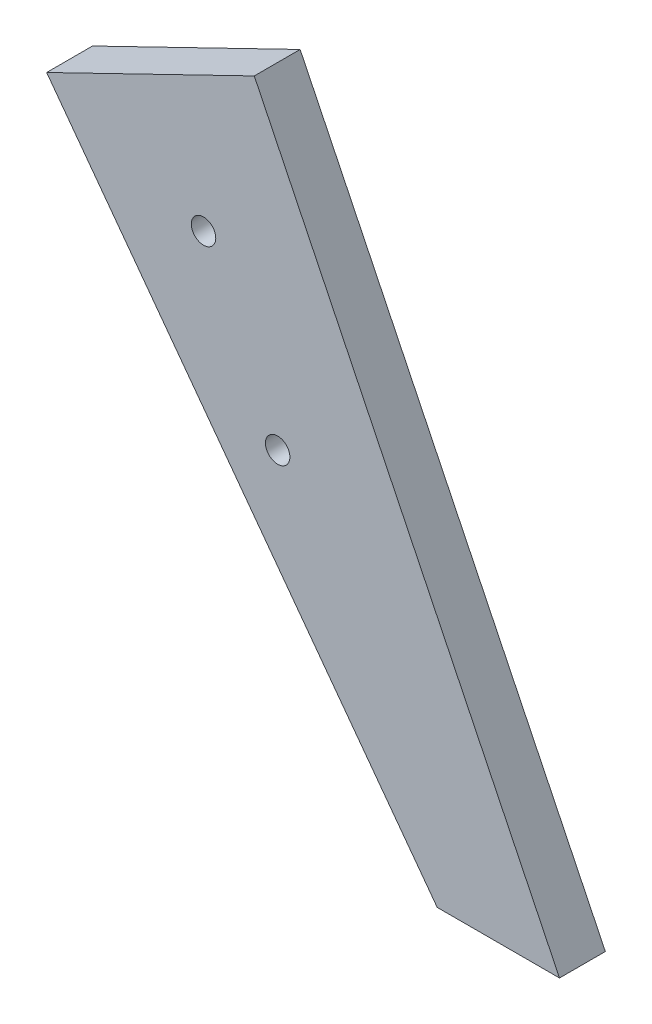
from build123d import *

# Parameters (mm, degrees)
SKETCH1_R           = 1.6
BOSS_EXTRUDE1_DEPTH = 6


with BuildPart() as part:
    # Sketch1 → Boss-Extrude1 (new body)
    with BuildSketch(Plane.XY):
        Polygon((-20.528429637, 7.707371577), (6.638285905, 20.898640153), (46.575535608, -61.35), (30.575535608, -61.35), align=None)
        Circle(SKETCH1_R, mode=Mode.SUBTRACT)
        with Locations((9.696892794, -19.970234604)):
            Circle(SKETCH1_R, mode=Mode.SUBTRACT)
    extrude(amount=BOSS_EXTRUDE1_DEPTH)


solid = part.part
